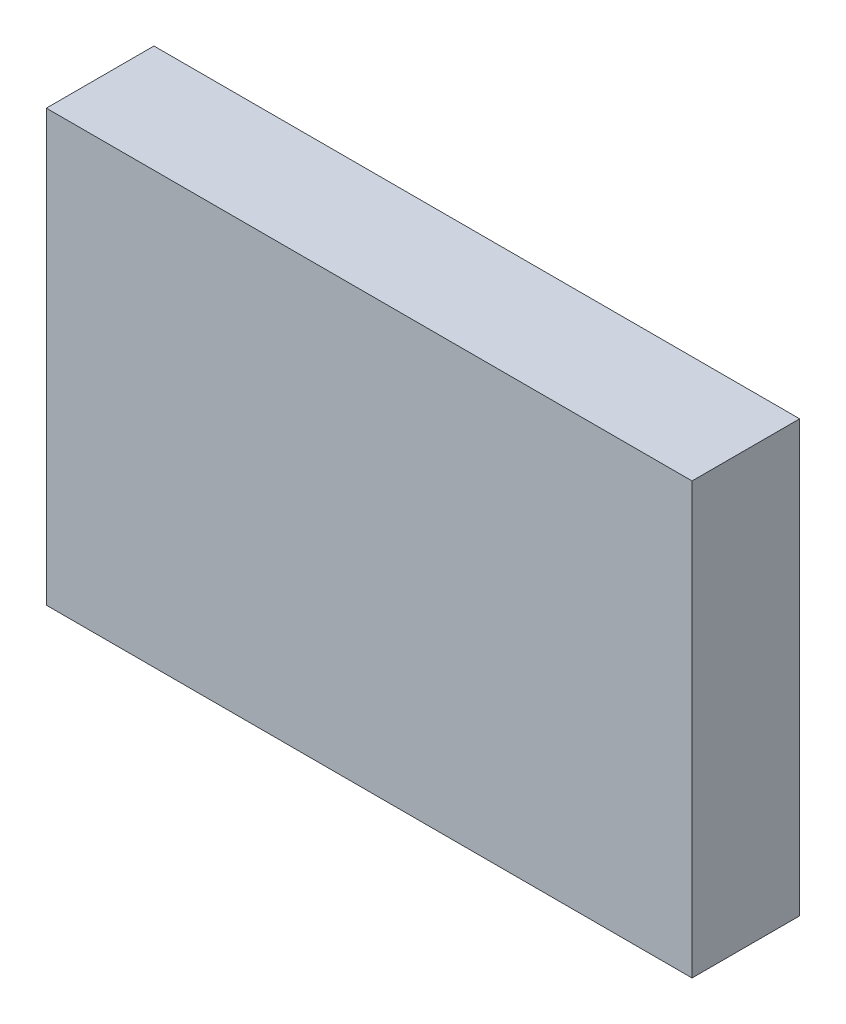
from build123d import *

# Parameters (mm, degrees)
SKETCH1_W           = 30
SKETCH1_H           = 20
BOSS_EXTRUDE1_DEPTH = 5


with BuildPart() as part:
    # Sketch1 → Boss-Extrude1 (new body)
    with BuildSketch(Plane.XY):
        with Locations((15, 10)):
            Rectangle(SKETCH1_W, SKETCH1_H)
    extrude(amount=BOSS_EXTRUDE1_DEPTH)


solid = part.part
